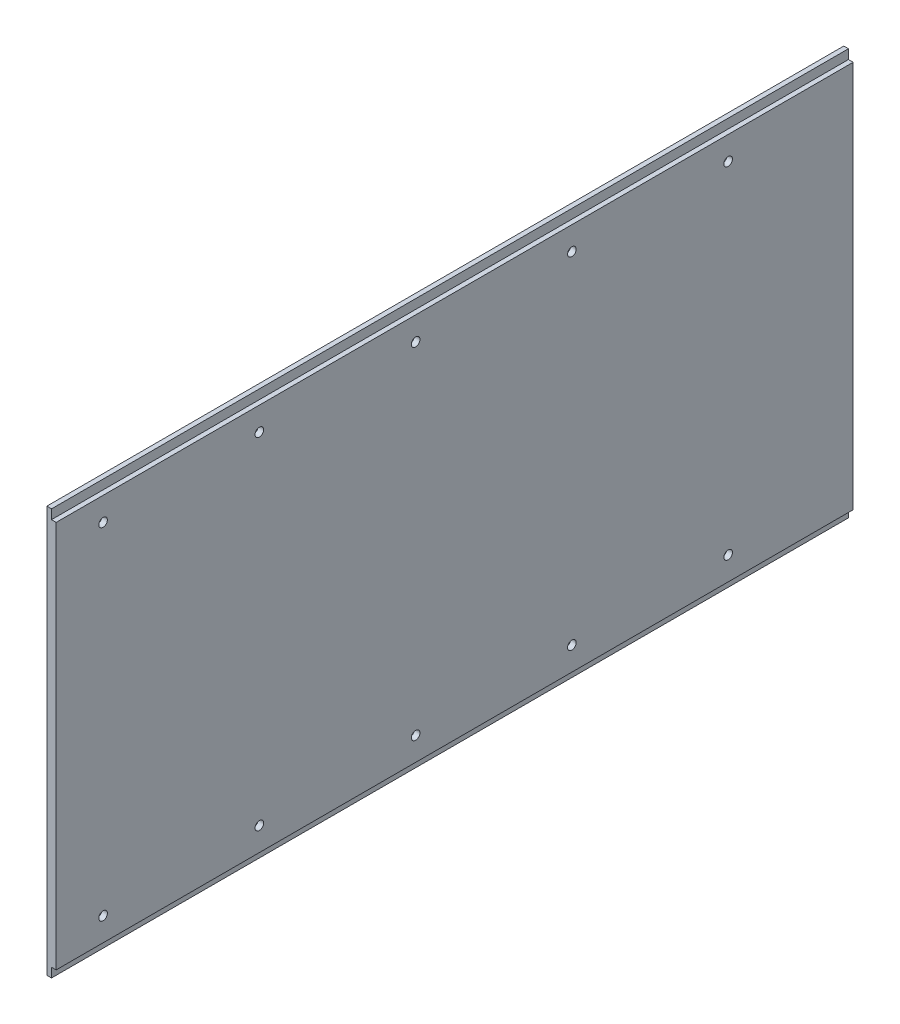
from build123d import *

# Parameters (mm, degrees)
SKETCH1_W                                            = 510
SKETCH1_H                                            = 260
BOSS_EXTRUDE1_DEPTH                                  = 6
SKIZZE2_W                                            = 3
SKIZZE2_H                                            = 6
SCHNITT_LINEAR_AUSTRAGEN1_DEPTH                      = 527.34209408
CSK_FOR_M5_COUNTERSUNK_RAISED_HEAD_SCREW_D           = 5.5
CSK_FOR_M5_COUNTERSUNK_RAISED_HEAD_SCREW_CSINK_D     = 10.4
CSK_FOR_M5_COUNTERSUNK_RAISED_HEAD_SCREW_CSINK_ANGLE = 90
LPATTERN1_COUNT                                      = 5
LPATTERN1_PITCH                                      = 100
MIRROR1_COPY_1_D                                     = 5.5
MIRROR1_COPY_1_CSINK_D                               = 10.4
MIRROR1_COPY_1_CSINK_ANGLE                           = 90
MIRROR1_COPY_2_D                                     = 5.5
MIRROR1_COPY_2_CSINK_D                               = 10.4
MIRROR1_COPY_2_CSINK_ANGLE                           = 90
MIRROR1_COPY_3_D                                     = 5.5
MIRROR1_COPY_3_CSINK_D                               = 10.4
MIRROR1_COPY_3_CSINK_ANGLE                           = 90
MIRROR1_COPY_4_D                                     = 5.5
MIRROR1_COPY_4_CSINK_D                               = 10.4
MIRROR1_COPY_4_CSINK_ANGLE                           = 90


with BuildPart() as part:
    # Sketch1 → Boss-Extrude1 (new body)
    with BuildSketch(Plane(origin=(0, 0, 0), x_dir=(0, 0, -1), z_dir=(1, 0, 0))):
        Rectangle(SKETCH1_W, SKETCH1_H)
    extrude(amount=BOSS_EXTRUDE1_DEPTH)

    # Skizze2 → Schnitt-Linear austragen1 (cut, through all)
    with BuildSketch(Plane.XY.offset(255)):
        with Locations((4.5, 127)):
            Rectangle(SKIZZE2_W, SKIZZE2_H)
        with Locations((4.5, -127)):
            Rectangle(SKIZZE2_W, SKIZZE2_H)
    extrude(amount=-SCHNITT_LINEAR_AUSTRAGEN1_DEPTH, mode=Mode.SUBTRACT)

    # CSK for M5 Countersunk Raised Head Screw1 (through all)
    with Locations(Plane.ZY):
        with Locations((225, -109)):
            csk_for_m5_countersunk_raised_head_screw = CounterSinkHole(CSK_FOR_M5_COUNTERSUNK_RAISED_HEAD_SCREW_D / 2, CSK_FOR_M5_COUNTERSUNK_RAISED_HEAD_SCREW_CSINK_D / 2, counter_sink_angle=CSK_FOR_M5_COUNTERSUNK_RAISED_HEAD_SCREW_CSINK_ANGLE)

    # LPattern1: CSK for M5 Countersunk Raised Head Screw1 ×5
    with Locations(*[(0, 0, -i * LPATTERN1_PITCH) for i in range(1, LPATTERN1_COUNT)]):
        add(csk_for_m5_countersunk_raised_head_screw, mode=Mode.SUBTRACT)

    # Mirror1: CSK for M5 Countersunk Raised Head Screw1 across plane
    add(csk_for_m5_countersunk_raised_head_screw.mirror(Plane.ZX), mode=Mode.SUBTRACT)

    # Mirror1 copy 1 (through all)
    with Locations(Plane(origin=(0, 0, -100), x_dir=(0, 0, 1), z_dir=(-1, 0, 0))):
        with Locations((225, 109)):
            CounterSinkHole(MIRROR1_COPY_1_D / 2, MIRROR1_COPY_1_CSINK_D / 2, counter_sink_angle=MIRROR1_COPY_1_CSINK_ANGLE)

    # Mirror1 copy 2 (through all)
    with Locations(Plane(origin=(0, 0, -200), x_dir=(0, 0, 1), z_dir=(-1, 0, 0))):
        with Locations((225, 109)):
            CounterSinkHole(MIRROR1_COPY_2_D / 2, MIRROR1_COPY_2_CSINK_D / 2, counter_sink_angle=MIRROR1_COPY_2_CSINK_ANGLE)

    # Mirror1 copy 3 (through all)
    with Locations(Plane(origin=(0, 0, -300), x_dir=(0, 0, 1), z_dir=(-1, 0, 0))):
        with Locations((225, 109)):
            CounterSinkHole(MIRROR1_COPY_3_D / 2, MIRROR1_COPY_3_CSINK_D / 2, counter_sink_angle=MIRROR1_COPY_3_CSINK_ANGLE)

    # Mirror1 copy 4 (through all)
    with Locations(Plane(origin=(0, 0, -400), x_dir=(0, 0, 1), z_dir=(-1, 0, 0))):
        with Locations((225, 109)):
            CounterSinkHole(MIRROR1_COPY_4_D / 2, MIRROR1_COPY_4_CSINK_D / 2, counter_sink_angle=MIRROR1_COPY_4_CSINK_ANGLE)


solid = part.part
